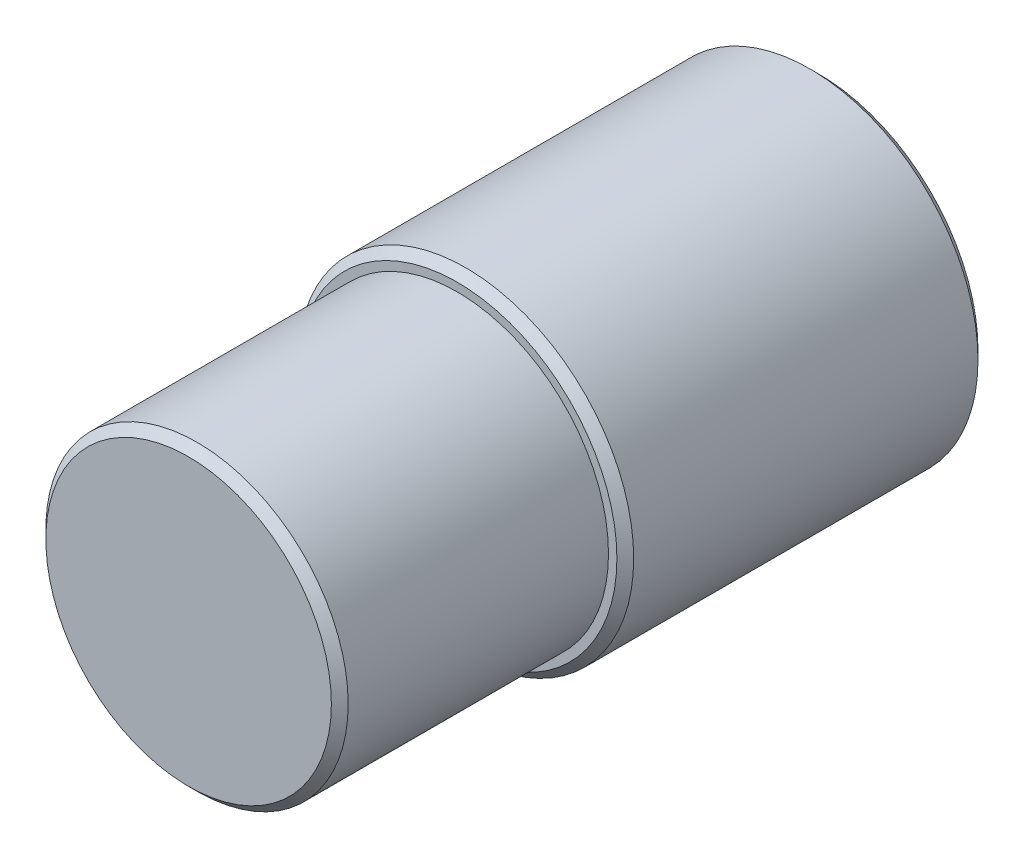
from build123d import *

# Parameters (mm, degrees)
SKETCH_1_R      = 10
EXTRUDE_1_DEPTH = 21.5
SKETCH_2_R      = 9
EXTRUDE_2_DEPTH = 16
CHAMFER_1_SIZE  = 0.5


with BuildPart() as part:
    # 草图1 → 凸台-拉伸1 (new body)
    with BuildSketch(Plane.XY):
        Circle(SKETCH_1_R)
    extrude(amount=EXTRUDE_1_DEPTH)

    # 草图2 → 凸台-拉伸2 (add)
    with BuildSketch(Plane.XY.offset(21.5)):
        Circle(SKETCH_2_R)
    extrude(amount=EXTRUDE_2_DEPTH)

    # 倒角1
    chamfer_1_edges = [part.edges().sort_by_distance(p)[0] for p in [
        (-10, 0, 0),
        (-10, 0, 21.5),
        (-9, 0, 37.5),
    ]]
    chamfer(chamfer_1_edges, length=CHAMFER_1_SIZE)


solid = part.part
